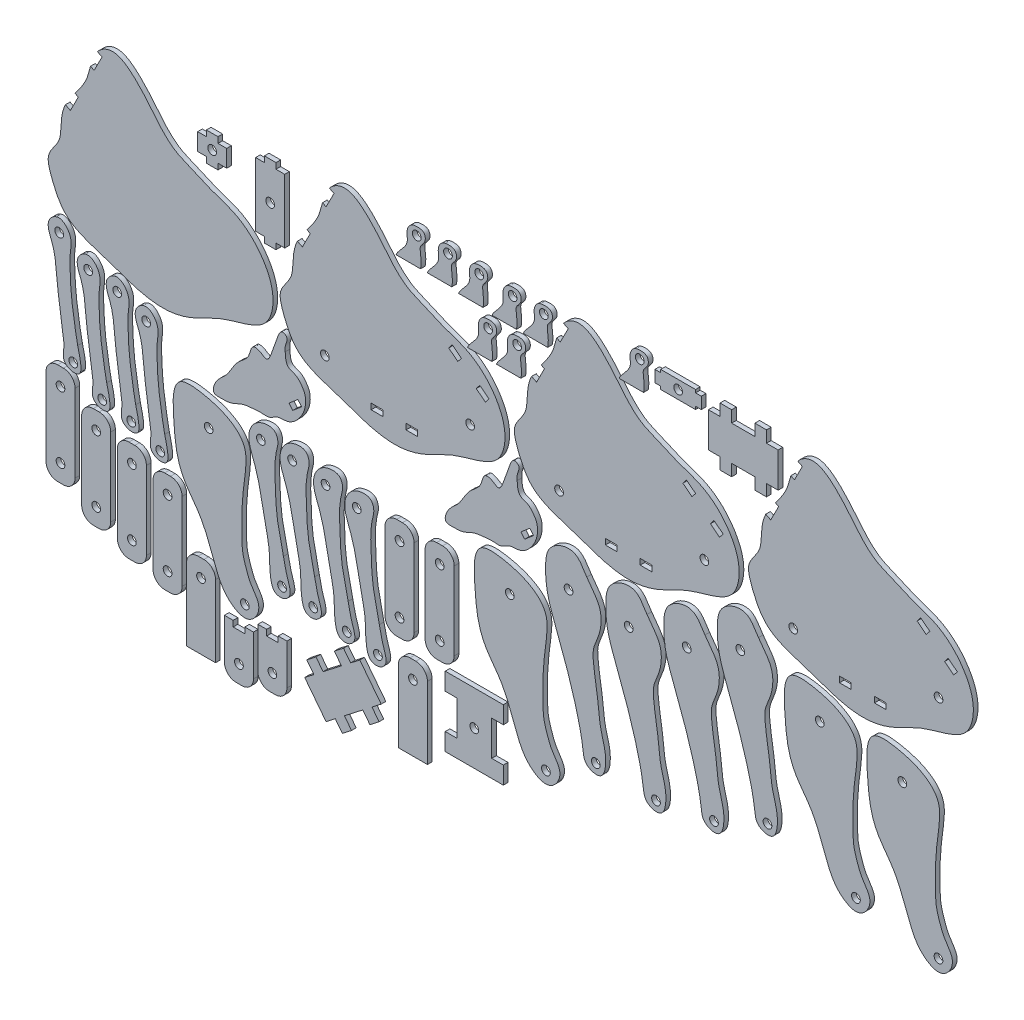
from build123d import *

# Parameters (mm, degrees)
MODEL_R                = 2.38125
BOSS_EXTRUDE1_DEPTH    = 2.54
BOSS_EXTRUDE1_2_DEPTH  = 2.54
MODEL_W                = 6.35
MODEL_H                = 3.175
BOSS_EXTRUDE1_3_DEPTH  = 2.54
BOSS_EXTRUDE1_4_DEPTH  = 2.54
BOSS_EXTRUDE1_5_DEPTH  = 2.54
BOSS_EXTRUDE1_6_DEPTH  = 2.54
BOSS_EXTRUDE1_7_DEPTH  = 2.54
BOSS_EXTRUDE1_8_DEPTH  = 2.54
BOSS_EXTRUDE1_9_DEPTH  = 2.54
BOSS_EXTRUDE1_10_DEPTH = 2.54
BOSS_EXTRUDE1_11_DEPTH = 2.54
BOSS_EXTRUDE1_12_DEPTH = 2.54
BOSS_EXTRUDE1_13_DEPTH = 2.54
BOSS_EXTRUDE1_14_DEPTH = 2.54
BOSS_EXTRUDE1_15_DEPTH = 2.54
BOSS_EXTRUDE1_16_DEPTH = 2.54
BOSS_EXTRUDE1_17_DEPTH = 2.54
BOSS_EXTRUDE1_18_DEPTH = 2.54
BOSS_EXTRUDE1_19_DEPTH = 2.54
BOSS_EXTRUDE1_20_DEPTH = 2.54
BOSS_EXTRUDE1_21_DEPTH = 2.54
BOSS_EXTRUDE1_22_DEPTH = 2.54
BOSS_EXTRUDE1_23_DEPTH = 2.54
BOSS_EXTRUDE1_24_DEPTH = 2.54
BOSS_EXTRUDE1_25_DEPTH = 2.54
BOSS_EXTRUDE1_26_DEPTH = 2.54
BOSS_EXTRUDE1_27_DEPTH = 2.54
BOSS_EXTRUDE1_28_DEPTH = 2.54
BOSS_EXTRUDE1_29_DEPTH = 2.54
BOSS_EXTRUDE1_30_DEPTH = 2.54
BOSS_EXTRUDE1_31_DEPTH = 2.54
BOSS_EXTRUDE1_32_DEPTH = 2.54
BOSS_EXTRUDE1_33_DEPTH = 2.54
BOSS_EXTRUDE1_34_DEPTH = 2.54
BOSS_EXTRUDE1_35_DEPTH = 2.54
BOSS_EXTRUDE1_36_DEPTH = 2.54
BOSS_EXTRUDE1_37_DEPTH = 2.54
BOSS_EXTRUDE1_38_DEPTH = 2.54
BOSS_EXTRUDE1_39_DEPTH = 2.54
BOSS_EXTRUDE1_40_DEPTH = 2.54
BOSS_EXTRUDE1_41_DEPTH = 2.54
BOSS_EXTRUDE1_42_DEPTH = 2.54
BOSS_EXTRUDE1_43_DEPTH = 2.54
BOSS_EXTRUDE1_44_DEPTH = 2.54
BOSS_EXTRUDE1_45_DEPTH = 2.54
BOSS_EXTRUDE1_46_DEPTH = 2.54


with BuildPart() as part:
    # Model → Boss-Extrude1 (new body)
    with BuildSketch(Plane.XY):
        Polygon((88.648005808, 248.103425007), (88.648005808, 257.501425007), (93.410505808, 257.501425007), (93.410505808, 260.676425007), (99.760505808, 260.676425007), (99.760505808, 257.501425007), (104.523005808, 257.501425007), (104.523005808, 248.103425007), (99.760505808, 248.103425007), (99.760505808, 244.928425007), (93.410505808, 244.928425007), (93.410505808, 248.103425007), align=None)
        with Locations((96.585505808, 252.802425007)):
            Circle(MODEL_R, mode=Mode.SUBTRACT)
    extrude(amount=BOSS_EXTRUDE1_DEPTH)


with BuildPart() as body_2:
    # Model → Boss-Extrude1 2 (new body)
    with BuildSketch(Plane.XY):
        Polygon((125.107490632, 261.093961602), (125.107490632, 264.268961602), (131.457490632, 264.268961602), (131.457490632, 261.093961602), (136.219990632, 261.093961602), (136.219990632, 226.168961602), (131.457490632, 226.168961602), (131.457490632, 222.993961602), (125.107490632, 222.993961602), (125.107490632, 226.168961602), (120.344990632, 226.168961602), (120.344990632, 261.093961602), align=None)
        with Locations((128.282490632, 243.631461602)):
            Circle(MODEL_R, mode=Mode.SUBTRACT)
    extrude(amount=BOSS_EXTRUDE1_2_DEPTH)


with BuildPart() as body_3:
    # Model → Boss-Extrude1 3 (new body)
    with BuildSketch(Plane.XY):
        with BuildLine():
            Line((145.880502868, 231.529608205), (143.166311499, 232.911205122))
            add(Edge.make_bspline(
                [(143.166311499, 232.911205122), (142.716383117, 231.989297683), (141.096791933, 228.063260503), (140.718036248, 221.741241161), (140.194792919, 212.443120236), (132.038202817, 205.734199668), (136.064707933, 192.599362016), (143.347472986, 176.876955583), (164.454316, 171.974233921), (182.194817562, 164.664395794), (198.568210286, 162.273634725), (214.172001811, 166.597778017), (227.830577654, 175.002712785), (241.973743075, 177.878513308), (254.085508749, 183.706957315), (258.494178761, 198.45442841), (251.844134376, 215.331757009), (237.952449535, 228.07367733), (223.155735014, 231.855560997), (212.996563339, 236.958591736), (200.492071838, 241.319738223), (191.303233754, 252.976535574), (181.510065648, 264.712681311), (170.384391065, 273.283752098), (163.181849451, 269.34900819), (161.542176613, 267.74024814), (161.223881959, 267.427954303), (160.928484227, 267.101300839), (160.653383952, 266.761824378)],
                knots=[0.111717033, 0.111717033, 0.111717033, 0.111717033, 0.120673769, 0.148903991, 0.164165853, 0.198706746, 0.223618805, 0.271958724, 0.340540865, 0.391818428, 0.438500031, 0.477150294, 0.527177937, 0.572977177, 0.600307039, 0.636040267, 0.690679969, 0.746912916, 0.789386341, 0.818681817, 0.843719063, 0.900659232, 0.937482649, 0.980493711, 1, 1, 1, 1.003786577, 1.003786577, 1.003786577, 1.003786577], degree=3))
            Line((160.653383952, 266.761824378), (163.164105613, 265.483799055))
            Line((163.164105613, 265.483799055), (158.843204926, 256.99525134))
            Line((158.843204926, 256.99525134), (156.892309132, 257.988310139))
            add(Edge.make_bspline(
                [(156.892309132, 257.988310139), (156.285114723, 255.691702896), (154.742688223, 249.307227776), (150.844009203, 244.152191963), (148.423358763, 240.923228872)],
                knots=[0.031107105, 0.031107105, 0.031107105, 0.031107105, 0.050670343, 0.084416466, 0.084416466, 0.084416466, 0.084416466], degree=3))
            Line((148.423358763, 240.923228872), (150.201403556, 240.018155917))
            Line((150.201403556, 240.018155917), (145.880502868, 231.529608205))
        make_face()
        with Locations((237.603757181, 193.287801903)):
            Circle(MODEL_R, mode=Mode.SUBTRACT)
        with Locations((158.182191028, 186.334551948)):
            Circle(MODEL_R, mode=Mode.SUBTRACT)
        with Locations((205.70992201, 174.833471323)):
            Rectangle(MODEL_W, MODEL_H, mode=Mode.SUBTRACT)
        with Locations((186.65992201, 174.833471323)):
            Rectangle(MODEL_W, MODEL_H, mode=Mode.SUBTRACT)
        Polygon((245.935614152, 208.131362924), (240.91683806, 212.021656815), (242.861985008, 214.531044859), (247.880761097, 210.640750968), align=None, mode=Mode.SUBTRACT)
        Polygon((227.805656739, 226.201926536), (232.824432828, 222.311632643), (230.879285883, 219.802244599), (225.860509794, 223.692538489), align=None, mode=Mode.SUBTRACT)
    extrude(amount=BOSS_EXTRUDE1_3_DEPTH)


with BuildPart() as body_4:
    # Model → Boss-Extrude1 4 (new body)
    with BuildSketch(Plane.XY):
        with BuildLine():
            add(Edge.make_bspline(
                [(197.14921886, 253.458493188), (198.221138496, 256.565680307), (204.744294263, 260.567384427), (202.375955295, 267.725571358), (204.800633298, 271.953761777), (208.582379665, 272.66991652), (213.002076358, 272.210843625), (213.469583738, 266.951735902), (209.89876913, 264.616110925), (210.744538477, 259.332298088), (211.014716514, 255.988816761), (210.459697284, 253.458493188)],
                knots=[0, 0, 0, 0, 0.237102494, 0.355084778, 0.441469893, 0.511003909, 0.597826044, 0.684225284, 0.771372373, 0.837925106, 1, 1, 1, 1], degree=3))
            Line((210.459697284, 253.458493188), (197.14921886, 253.458493188))
        make_face()
        with Locations((208.394278219, 268.184942589)):
            Circle(MODEL_R, mode=Mode.SUBTRACT)
    extrude(amount=BOSS_EXTRUDE1_4_DEPTH)


with BuildPart() as body_5:
    # Model → Boss-Extrude1 5 (new body)
    with BuildSketch(Plane.XY):
        with BuildLine():
            add(Edge.make_bspline(
                [(214.216823841, 253.458493188), (215.288743477, 256.565680307), (221.811899244, 260.567384427), (219.443560276, 267.725571358), (221.868238279, 271.953761777), (225.649984646, 272.66991652), (230.069681339, 272.210843625), (230.537188719, 266.951735902), (226.966374111, 264.616110925), (227.812143459, 259.332298088), (228.082321495, 255.988816761), (227.527302265, 253.458493188)],
                knots=[0, 0, 0, 0, 0.237102494, 0.355084778, 0.441469893, 0.511003909, 0.597826044, 0.684225284, 0.771372373, 0.837925106, 1, 1, 1, 1], degree=3))
            Line((227.527302265, 253.458493188), (214.216823841, 253.458493188))
        make_face()
        with Locations((225.4618832, 268.184942589)):
            Circle(MODEL_R, mode=Mode.SUBTRACT)
    extrude(amount=BOSS_EXTRUDE1_5_DEPTH)


with BuildPart() as body_6:
    # Model → Boss-Extrude1 6 (new body)
    with BuildSketch(Plane.XY):
        with BuildLine():
            add(Edge.make_bspline(
                [(231.284434599, 252.239912814), (232.356354235, 255.347099933), (238.879510002, 259.348804053), (236.511171034, 266.506990984), (238.935849037, 270.735181403), (242.717595404, 271.451336146), (247.137292097, 270.992263251), (247.604799477, 265.733155528), (244.033984869, 263.397530551), (244.879754217, 258.113717714), (245.149932253, 254.770236387), (244.594913023, 252.239912814)],
                knots=[0, 0, 0, 0, 0.237102494, 0.355084778, 0.441469893, 0.511003909, 0.597826044, 0.684225284, 0.771372373, 0.837925106, 1, 1, 1, 1], degree=3))
            Line((244.594913023, 252.239912814), (231.284434599, 252.239912814))
        make_face()
        with Locations((242.529493958, 266.966362215)):
            Circle(MODEL_R, mode=Mode.SUBTRACT)
    extrude(amount=BOSS_EXTRUDE1_6_DEPTH)


with BuildPart() as body_7:
    # Model → Boss-Extrude1 7 (new body)
    with BuildSketch(Plane.XY):
        with BuildLine():
            add(Edge.make_bspline(
                [(249.571155047, 251.02132966), (250.643074683, 254.128516779), (257.16623045, 258.130220898), (254.797891482, 265.288407829), (257.222569485, 269.516598248), (261.004315852, 270.232752992), (265.424012545, 269.773680097), (265.891519925, 264.514572373), (262.320705317, 262.178947397), (263.166474665, 256.89513456), (263.436652701, 253.551653233), (262.881633471, 251.02132966)],
                knots=[0, 0, 0, 0, 0.237102494, 0.355084778, 0.441469893, 0.511003909, 0.597826044, 0.684225284, 0.771372373, 0.837925106, 1, 1, 1, 1], degree=3))
            Line((262.881633471, 251.02132966), (249.571155047, 251.02132966))
        make_face()
        with Locations((260.816214406, 265.747779061)):
            Circle(MODEL_R, mode=Mode.SUBTRACT)
    extrude(amount=BOSS_EXTRUDE1_7_DEPTH)


with BuildPart() as body_8:
    # Model → Boss-Extrude1 8 (new body)
    with BuildSketch(Plane.XY):
        with BuildLine():
            add(Edge.make_bspline(
                [(266.638760029, 251.02132966), (267.710679664, 254.128516779), (274.233835431, 258.130220898), (271.865496463, 265.288407829), (274.290174466, 269.516598248), (278.071920834, 270.232752992), (282.491617526, 269.773680097), (282.959124906, 264.514572373), (279.388310298, 262.178947397), (280.234079646, 256.89513456), (280.504257683, 253.551653233), (279.949238452, 251.02132966)],
                knots=[0, 0, 0, 0, 0.237102494, 0.355084778, 0.441469893, 0.511003909, 0.597826044, 0.684225284, 0.771372373, 0.837925106, 1, 1, 1, 1], degree=3))
            Line((279.949238452, 251.02132966), (266.638760029, 251.02132966))
        make_face()
        with Locations((277.883819388, 265.747779061)):
            Circle(MODEL_R, mode=Mode.SUBTRACT)
    extrude(amount=BOSS_EXTRUDE1_8_DEPTH)


with BuildPart() as body_9:
    # Model → Boss-Extrude1 9 (new body)
    with BuildSketch(Plane.XY):
        with BuildLine():
            add(Edge.make_bspline(
                [(252.009385981, 229.086866246), (253.081305617, 232.194053365), (259.604461384, 236.195757484), (257.236122416, 243.353944416), (259.660800418, 247.582134835), (263.442546786, 248.298289578), (267.862243479, 247.839216683), (268.329750859, 242.58010896), (264.758936251, 240.244483983), (265.604705598, 234.960671146), (265.874883635, 231.617189819), (265.319864404, 229.086866246)],
                knots=[0, 0, 0, 0, 0.237102494, 0.355084778, 0.441469893, 0.511003909, 0.597826044, 0.684225284, 0.771372373, 0.837925106, 1, 1, 1, 1], degree=3))
            Line((265.319864404, 229.086866246), (252.009385981, 229.086866246))
        make_face()
        with Locations((263.25444534, 243.813315647)):
            Circle(MODEL_R, mode=Mode.SUBTRACT)
    extrude(amount=BOSS_EXTRUDE1_9_DEPTH)


with BuildPart() as body_10:
    # Model → Boss-Extrude1 10 (new body)
    with BuildSketch(Plane.XY):
        with BuildLine():
            add(Edge.make_bspline(
                [(236.16089069, 229.086866246), (237.232810325, 232.194053365), (243.755966092, 236.195757484), (241.387627124, 243.353944416), (243.812305127, 247.582134835), (247.594051495, 248.298289578), (252.013748187, 247.839216683), (252.481255567, 242.58010896), (248.910440959, 240.244483983), (249.756210307, 234.960671146), (250.026388344, 231.617189819), (249.471369113, 229.086866246)],
                knots=[0, 0, 0, 0, 0.237102494, 0.355084778, 0.441469893, 0.511003909, 0.597826044, 0.684225284, 0.771372373, 0.837925106, 1, 1, 1, 1], degree=3))
            Line((249.471369113, 229.086866246), (236.16089069, 229.086866246))
        make_face()
        with Locations((247.405950049, 243.813315647)):
            Circle(MODEL_R, mode=Mode.SUBTRACT)
    extrude(amount=BOSS_EXTRUDE1_10_DEPTH)


with BuildPart() as body_11:
    # Model → Boss-Extrude1 11 (new body)
    with BuildSketch(Plane.XY):
        with BuildLine():
            Line((273.887551781, 231.529608205), (271.173360412, 232.911205122))
            add(Edge.make_bspline(
                [(271.173360412, 232.911205122), (270.72343203, 231.989297683), (269.103840846, 228.063260503), (268.725085161, 221.741241161), (268.201841832, 212.443120236), (260.045251729, 205.734199668), (264.071756846, 192.599362016), (271.354521899, 176.876955583), (292.461364913, 171.974233921), (310.201866474, 164.664395794), (326.575259199, 162.273634725), (342.179050723, 166.597778017), (355.837626567, 175.002712785), (369.980791987, 177.878513308), (382.092557662, 183.706957315), (386.501227674, 198.45442841), (379.851183289, 215.331757009), (365.959498448, 228.07367733), (351.162783927, 231.855560997), (341.003612252, 236.958591736), (328.499120751, 241.319738223), (319.310282667, 252.976535574), (309.517114561, 264.712681311), (298.391439978, 273.283752098), (291.188898364, 269.34900819), (289.549225526, 267.74024814), (289.230930872, 267.427954303), (288.93553314, 267.101300839), (288.660432865, 266.761824378)],
                knots=[0.111717033, 0.111717033, 0.111717033, 0.111717033, 0.120673769, 0.148903991, 0.164165853, 0.198706746, 0.223618805, 0.271958724, 0.340540865, 0.391818428, 0.438500031, 0.477150294, 0.527177937, 0.572977177, 0.600307039, 0.636040267, 0.690679969, 0.746912916, 0.789386341, 0.818681817, 0.843719063, 0.900659232, 0.937482649, 0.980493711, 1, 1, 1, 1.003786577, 1.003786577, 1.003786577, 1.003786577], degree=3))
            Line((288.660432865, 266.761824378), (291.171154526, 265.483799055))
            Line((291.171154526, 265.483799055), (286.850253839, 256.99525134))
            Line((286.850253839, 256.99525134), (284.899358045, 257.988310139))
            add(Edge.make_bspline(
                [(284.899358045, 257.988310139), (284.292163636, 255.691702896), (282.749737136, 249.307227776), (278.851058116, 244.152191963), (276.430407676, 240.923228872)],
                knots=[0.031107105, 0.031107105, 0.031107105, 0.031107105, 0.050670343, 0.084416466, 0.084416466, 0.084416466, 0.084416466], degree=3))
            Line((276.430407676, 240.923228872), (278.208452468, 240.018155917))
            Line((278.208452468, 240.018155917), (273.887551781, 231.529608205))
        make_face()
        with Locations((365.610806094, 193.287801903)):
            Circle(MODEL_R, mode=Mode.SUBTRACT)
        with Locations((286.189239941, 186.334551948)):
            Circle(MODEL_R, mode=Mode.SUBTRACT)
        with Locations((333.716970923, 174.833471323)):
            Rectangle(MODEL_W, MODEL_H, mode=Mode.SUBTRACT)
        with Locations((314.666970923, 174.833471323)):
            Rectangle(MODEL_W, MODEL_H, mode=Mode.SUBTRACT)
        Polygon((373.942663065, 208.131362924), (368.923886973, 212.021656815), (370.869033921, 214.531044859), (375.88781001, 210.640750968), align=None, mode=Mode.SUBTRACT)
        Polygon((355.812705652, 226.201926536), (360.831481741, 222.311632643), (358.886334795, 219.802244599), (353.867558706, 223.692538489), align=None, mode=Mode.SUBTRACT)
    extrude(amount=BOSS_EXTRUDE1_11_DEPTH)


with BuildPart() as body_12:
    # Model → Boss-Extrude1 12 (new body)
    with BuildSketch(Plane.XY):
        with BuildLine():
            add(Edge.make_bspline(
                [(263.299624276, 179.652063381), (263.241981149, 180.859426047), (263.12906818, 183.150915031), (265.225764634, 186.625350208), (260.678120712, 189.738589425), (258.837334009, 183.271405269), (256.950884143, 179.075576595), (255.849672524, 175.068902114), (253.609625622, 169.783248822), (249.821036331, 173.033387233), (245.860062411, 174.163908015), (244.071712828, 170.617005334), (243.240982011, 165.986291116), (235.860455394, 161.774406799), (232.414088718, 152.38598108), (225.398530726, 148.286895828), (223.450545935, 141.784178074), (224.43328026, 140.785719364)],
                knots=[0.516873244, 0.516873244, 0.516873244, 0.516873244, 0.538667761, 0.562806149, 0.5778991, 0.616936064, 0.645339628, 0.673283981, 0.701186966, 0.724121111, 0.750378426, 0.764142362, 0.791670233, 0.838296487, 0.910523172, 0.966353976, 1, 1, 1, 1], degree=3))
            add(Edge.make_bspline(
                [(224.43328026, 140.785719364), (225.177482966, 140.029608932), (229.079673387, 140.195746086), (234.039222499, 140.14067572), (239.191465944, 143.380432086), (244.845324945, 143.867293863), (249.623813898, 144.496380293), (253.964397791, 143.691265353), (256.837200083, 145.477270748), (259.937286688, 147.266690273), (265.387732358, 146.542827606), (271.166749485, 151.48129139), (274.64471859, 158.246434834), (274.612580923, 164.630286604), (271.958481614, 168.761760035), (269.394206183, 171.811078936), (263.617928641, 172.771599367), (263.411740885, 177.303727807), (263.299624276, 179.652063381)],
                knots=[0, 0, 0, 0, 0.025479381, 0.057543235, 0.099955641, 0.133033817, 0.163895948, 0.191559966, 0.211929865, 0.225609617, 0.258491648, 0.308276257, 0.356004359, 0.401628858, 0.418999158, 0.448323204, 0.474482632, 0.516873244, 0.516873244, 0.516873244, 0.516873244], degree=3))
        make_face()
        Polygon((272.250986165, 158.097804863), (270.188988613, 160.512093804), (265.360410731, 156.388098696), (267.422408284, 153.973809756), align=None, mode=Mode.SUBTRACT)
    extrude(amount=BOSS_EXTRUDE1_12_DEPTH)


with BuildPart() as body_13:
    # Model → Boss-Extrude1 13 (new body)
    with BuildSketch(Plane.XY):
        with BuildLine():
            add(Edge.make_bspline(
                [(136.51169083, 177.214902633), (136.454047703, 178.422265299), (136.341134734, 180.713754283), (138.437831188, 184.18818946), (133.890187266, 187.301428677), (132.049400563, 180.834244521), (130.162950697, 176.638415847), (129.061739078, 172.631741366), (126.821692176, 167.346088074), (123.033102885, 170.596226486), (119.072128965, 171.726747267), (117.283779382, 168.179844586), (116.453048565, 163.549130368), (109.072521948, 159.337246051), (105.626155272, 149.948820332), (98.61059728, 145.84973508), (96.662612489, 139.347017326), (97.645346813, 138.348558616)],
                knots=[0.516873244, 0.516873244, 0.516873244, 0.516873244, 0.538667761, 0.562806149, 0.5778991, 0.616936064, 0.645339628, 0.673283981, 0.701186966, 0.724121111, 0.750378426, 0.764142362, 0.791670233, 0.838296487, 0.910523172, 0.966353976, 1, 1, 1, 1], degree=3))
            add(Edge.make_bspline(
                [(97.645346813, 138.348558616), (98.38954952, 137.592448184), (102.291739941, 137.758585338), (107.251289053, 137.703514972), (112.403532498, 140.943271338), (118.057391499, 141.430133115), (122.835880452, 142.059219545), (127.176464345, 141.254104605), (130.049266637, 143.04011), (133.149353242, 144.829529526), (138.599798912, 144.105666858), (144.378816039, 149.044130642), (147.856785144, 155.809274086), (147.824647477, 162.193125857), (145.170548168, 166.324599287), (142.606272737, 169.373918188), (136.829995195, 170.334438619), (136.623807439, 174.866567059), (136.51169083, 177.214902633)],
                knots=[0, 0, 0, 0, 0.025479381, 0.057543235, 0.099955641, 0.133033817, 0.163895948, 0.191559966, 0.211929865, 0.225609617, 0.258491648, 0.308276257, 0.356004359, 0.401628858, 0.418999158, 0.448323204, 0.474482632, 0.516873244, 0.516873244, 0.516873244, 0.516873244], degree=3))
        make_face()
        Polygon((145.463052719, 155.660644115), (143.401055167, 158.074933056), (138.572477285, 153.950937949), (140.634474838, 151.536649008), align=None, mode=Mode.SUBTRACT)
    extrude(amount=BOSS_EXTRUDE1_13_DEPTH)


with BuildPart() as body_14:
    # Model → Boss-Extrude1 14 (new body)
    with BuildSketch(Plane.XY):
        with BuildLine():
            add(Edge.make_bspline(
                [(319.060696216, 255.895653936), (320.132615852, 259.002841055), (326.655771619, 263.004545174), (324.287432651, 270.162732106), (326.712110653, 274.390922525), (330.493857021, 275.107077268), (334.913553714, 274.648004373), (335.381061094, 269.38889665), (331.810246485, 267.053271673), (332.656015833, 261.769458836), (332.92619387, 258.425977509), (332.371174639, 255.895653936)],
                knots=[0, 0, 0, 0, 0.237102494, 0.355084778, 0.441469893, 0.511003909, 0.597826044, 0.684225284, 0.771372373, 0.837925106, 1, 1, 1, 1], degree=3))
            Line((332.371174639, 255.895653936), (319.060696216, 255.895653936))
        make_face()
        with Locations((330.305755575, 270.622103337)):
            Circle(MODEL_R, mode=Mode.SUBTRACT)
    extrude(amount=BOSS_EXTRUDE1_14_DEPTH)


with BuildPart() as body_15:
    # Model → Boss-Extrude1 15 (new body)
    with BuildSketch(Plane.XY):
        Polygon((341.741532095, 269.926061371), (341.741532095, 271.513561371), (360.791532095, 271.513561371), (360.791532095, 269.926061371), (363.966532095, 269.926061371), (363.966532095, 263.576061371), (360.791532095, 263.576061371), (360.791532095, 261.988561371), (341.741532095, 261.988561371), (341.741532095, 263.576061371), (338.566532095, 263.576061371), (338.566532095, 269.926061371), align=None)
        with Locations((351.266532095, 266.751061371)):
            Circle(MODEL_R, mode=Mode.SUBTRACT)
    extrude(amount=BOSS_EXTRUDE1_15_DEPTH)


with BuildPart() as body_16:
    # Model → Boss-Extrude1 16 (new body)
    with BuildSketch(Plane.XY):
        Polygon((393.22528591, 240.054097955), (393.22528591, 246.404097955), (380.52528591, 246.404097955), (380.52528591, 240.054097955), (374.17528591, 240.054097955), (374.17528591, 246.404097955), (367.82528591, 246.404097955), (367.82528591, 265.454097955), (374.17528591, 265.454097955), (374.17528591, 271.804097955), (380.52528591, 271.804097955), (380.52528591, 265.454097955), (393.22528591, 265.454097955), (393.22528591, 271.804097955), (399.57528591, 271.804097955), (399.57528591, 265.454097955), (405.92528591, 265.454097955), (405.92528591, 246.404097955), (399.57528591, 246.404097955), (399.57528591, 240.054097955), align=None)
    extrude(amount=BOSS_EXTRUDE1_16_DEPTH)


with BuildPart() as body_17:
    # Model → Boss-Extrude1 17 (new body)
    with BuildSketch(Plane.XY):
        with BuildLine():
            Line((401.894600694, 230.311027831), (399.180409325, 231.692624748))
            add(Edge.make_bspline(
                [(399.180409325, 231.692624748), (398.730480943, 230.770717309), (397.110889759, 226.844680129), (396.732134074, 220.522660787), (396.208890744, 211.224539862), (388.052300642, 204.515619294), (392.078805759, 191.380781642), (399.361570811, 175.658375209), (420.468413825, 170.755653547), (438.208915387, 163.44581542), (454.582308112, 161.055054351), (470.186099636, 165.379197644), (483.84467548, 173.784132411), (497.9878409, 176.659932934), (510.099606575, 182.488376941), (514.508276587, 197.235848036), (507.858232202, 214.113176636), (493.966547361, 226.855096956), (479.16983284, 230.636980623), (469.010661165, 235.740011362), (456.506169664, 240.101157849), (447.317331579, 251.7579552), (437.524163474, 263.494100937), (426.398488891, 272.065171724), (419.195947277, 268.130427816), (417.556274439, 266.521667766), (417.237979785, 266.209373929), (416.942582053, 265.882720465), (416.667481778, 265.543244004)],
                knots=[0.111717033, 0.111717033, 0.111717033, 0.111717033, 0.120673769, 0.148903991, 0.164165853, 0.198706746, 0.223618805, 0.271958724, 0.340540865, 0.391818428, 0.438500031, 0.477150294, 0.527177937, 0.572977177, 0.600307039, 0.636040267, 0.690679969, 0.746912916, 0.789386341, 0.818681817, 0.843719063, 0.900659232, 0.937482649, 0.980493711, 1, 1, 1, 1.003786577, 1.003786577, 1.003786577, 1.003786577], degree=3))
            Line((416.667481778, 265.543244004), (419.178203439, 264.265218681))
            Line((419.178203439, 264.265218681), (414.857302751, 255.776670966))
            Line((414.857302751, 255.776670966), (412.906406958, 256.769729765))
            add(Edge.make_bspline(
                [(412.906406958, 256.769729765), (412.299212549, 254.473122522), (410.756786049, 248.088647402), (406.858107029, 242.933611589), (404.437456588, 239.704648498)],
                knots=[0.031107105, 0.031107105, 0.031107105, 0.031107105, 0.050670343, 0.084416466, 0.084416466, 0.084416466, 0.084416466], degree=3))
            Line((404.437456588, 239.704648498), (406.215501381, 238.799575543))
            Line((406.215501381, 238.799575543), (401.894600694, 230.311027831))
        make_face()
        with Locations((493.617855007, 192.069221529)):
            Circle(MODEL_R, mode=Mode.SUBTRACT)
        with Locations((414.196288854, 185.115971574)):
            Circle(MODEL_R, mode=Mode.SUBTRACT)
        with Locations((461.724019836, 173.614890949)):
            Rectangle(MODEL_W, MODEL_H, mode=Mode.SUBTRACT)
        with Locations((442.674019836, 173.614890949)):
            Rectangle(MODEL_W, MODEL_H, mode=Mode.SUBTRACT)
        Polygon((501.949711978, 206.91278255), (496.930935886, 210.803076441), (498.876082834, 213.312464485), (503.894858923, 209.422170595), align=None, mode=Mode.SUBTRACT)
        Polygon((483.819754565, 224.983346162), (488.838530654, 221.093052269), (486.893383708, 218.583664225), (481.874607619, 222.473958115), align=None, mode=Mode.SUBTRACT)
    extrude(amount=BOSS_EXTRUDE1_17_DEPTH)


with BuildPart() as body_18:
    # Model → Boss-Extrude1 18 (new body)
    with BuildSketch(Plane.XY):
        with BuildLine():
            add(Edge.make_bspline(
                [(500.106266209, 66.636149591), (500.992694915, 68.287724645), (502.035740007, 73.227919443), (496.953466476, 78.675739778), (494.269200758, 85.829892452), (491.816661547, 93.330524017), (492.020407497, 102.432484095), (491.684815872, 114.43405555), (493.391325284, 127.357085859), (496.078711515, 148.410499085), (476.054264234, 156.87350319), (461.109981827, 158.003275783), (458.491633784, 156.448044677)],
                knots=[0.496264859, 0.496264859, 0.496264859, 0.496264859, 0.519240724, 0.556864446, 0.58362393, 0.618875008, 0.657601159, 0.700502293, 0.77344688, 0.830648391, 0.952543987, 1, 1, 1, 1], degree=3))
            add(Edge.make_bspline(
                [(458.491633784, 156.448044677), (453.720550929, 153.614144699), (454.743748495, 132.557176384), (456.78383643, 113.721855283), (471.095995661, 97.234022757), (476.345836767, 80.623827147), (482.812833179, 66.128281152), (494.40009239, 60.340073635), (499.011017191, 64.595504986), (500.106266209, 66.636149591)],
                knots=[0, 0, 0, 0, 0.086473061, 0.201223986, 0.263840681, 0.357440163, 0.42530964, 0.467876457, 0.496264859, 0.496264859, 0.496264859, 0.496264859], degree=3))
        make_face()
        with Locations((493.579321876, 68.568012903)):
            Circle(MODEL_R, mode=Mode.SUBTRACT)
        with Locations((473.824999856, 142.162895617)):
            Circle(MODEL_R, mode=Mode.SUBTRACT)
    extrude(amount=BOSS_EXTRUDE1_18_DEPTH)


with BuildPart() as body_19:
    # Model → Boss-Extrude1 19 (new body)
    with BuildSketch(Plane.XY):
        with BuildLine():
            add(Edge.make_bspline(
                [(454.999022823, 72.729054241), (455.885451528, 74.380629295), (456.928496621, 79.320824094), (451.846223089, 84.768644428), (449.161957371, 91.922797103), (446.709418161, 99.423428667), (446.913164111, 108.525388746), (446.577572486, 120.526960201), (448.284081897, 133.449990509), (450.971468129, 154.503403735), (430.947020847, 162.96640784), (416.00273844, 164.096180433), (413.384390397, 162.540949328)],
                knots=[0.496264859, 0.496264859, 0.496264859, 0.496264859, 0.519240724, 0.556864446, 0.58362393, 0.618875008, 0.657601159, 0.700502293, 0.77344688, 0.830648391, 0.952543987, 1, 1, 1, 1], degree=3))
            add(Edge.make_bspline(
                [(413.384390397, 162.540949328), (408.613307542, 159.707049349), (409.636505109, 138.650081034), (411.676593043, 119.814759933), (425.988752275, 103.326927407), (431.23859338, 86.716731797), (437.705589793, 72.221185802), (449.292849003, 66.432978285), (453.903773805, 70.688409636), (454.999022823, 72.729054241)],
                knots=[0, 0, 0, 0, 0.086473061, 0.201223986, 0.263840681, 0.357440163, 0.42530964, 0.467876457, 0.496264859, 0.496264859, 0.496264859, 0.496264859], degree=3))
        make_face()
        with Locations((448.472078489, 74.660917553)):
            Circle(MODEL_R, mode=Mode.SUBTRACT)
        with Locations((428.717756469, 148.255800267)):
            Circle(MODEL_R, mode=Mode.SUBTRACT)
    extrude(amount=BOSS_EXTRUDE1_19_DEPTH)


with BuildPart() as body_20:
    # Model → Boss-Extrude1 20 (new body)
    with BuildSketch(Plane.XY):
        with BuildLine():
            add(Edge.make_bspline(
                [(395.200113675, 171.285267524), (393.116414129, 174.402368023), (388.993586041, 182.725696545), (373.550793521, 177.044195916), (372.401629759, 164.49853627), (373.118075148, 153.029869863), (378.655876197, 137.965015414), (385.143611599, 121.206584402), (390.343034919, 103.510207245), (392.57438803, 93.13976791), (393.135311146, 88.505457048)],
                knots=[0.485935555, 0.485935555, 0.485935555, 0.485935555, 0.533485289, 0.596799765, 0.638978483, 0.694684703, 0.752921318, 0.85362628, 0.938944148, 1, 1, 1, 1], degree=3))
            add(Edge.make_bspline(
                [(393.135311146, 88.505457048), (393.373323309, 86.539015803), (393.78320615, 81.704360575), (404.145487903, 78.533410455), (405.985579041, 88.621233115), (404.928515341, 96.142457036), (402.173665304, 104.722776909), (401.439933388, 116.865415805), (399.136494401, 128.348337095), (398.219801099, 139.525435682), (402.956902837, 148.169792248), (404.024830809, 160.958693349), (397.749774382, 167.471114627), (395.200113675, 171.285267524)],
                knots=[0, 0, 0, 0, 0.025907357, 0.061945247, 0.099210204, 0.132366352, 0.170723321, 0.218452269, 0.29619423, 0.330868793, 0.365117885, 0.427752651, 0.485935555, 0.485935555, 0.485935555, 0.485935555], degree=3))
        make_face()
        with Locations((400.123158849, 85.663433847)):
            Circle(MODEL_R, mode=Mode.SUBTRACT)
        with Locations((385.251519671, 160.398126917)):
            Circle(MODEL_R, mode=Mode.SUBTRACT)
    extrude(amount=BOSS_EXTRUDE1_20_DEPTH)


with BuildPart() as body_21:
    # Model → Boss-Extrude1 21 (new body)
    with BuildSketch(Plane.XY):
        with BuildLine():
            add(Edge.make_bspline(
                [(365.941359803, 157.880872289), (363.857660257, 160.997972787), (359.734832169, 169.32130131), (344.292039649, 163.639800681), (343.142875887, 151.094141034), (343.859321276, 139.625474627), (349.397122325, 124.560620178), (355.884857727, 107.802189167), (361.084281046, 90.10581201), (363.315634158, 79.735372675), (363.876557274, 75.101061813)],
                knots=[0.485935555, 0.485935555, 0.485935555, 0.485935555, 0.533485289, 0.596799765, 0.638978483, 0.694684703, 0.752921318, 0.85362628, 0.938944148, 1, 1, 1, 1], degree=3))
            add(Edge.make_bspline(
                [(363.876557274, 75.101061813), (364.114569437, 73.134620568), (364.524452278, 68.29996534), (374.886734031, 65.12901522), (376.726825169, 75.21683788), (375.669761469, 82.738061801), (372.914911431, 91.318381674), (372.181179515, 103.46102057), (369.877740529, 114.94394186), (368.961047227, 126.121040446), (373.698148965, 134.765397013), (374.766076937, 147.554298114), (368.49102051, 154.066719392), (365.941359803, 157.880872289)],
                knots=[0, 0, 0, 0, 0.025907357, 0.061945247, 0.099210204, 0.132366352, 0.170723321, 0.218452269, 0.29619423, 0.330868793, 0.365117885, 0.427752651, 0.485935555, 0.485935555, 0.485935555, 0.485935555], degree=3))
        make_face()
        with Locations((370.864404976, 72.259038612)):
            Circle(MODEL_R, mode=Mode.SUBTRACT)
        with Locations((355.992765799, 146.993731682)):
            Circle(MODEL_R, mode=Mode.SUBTRACT)
    extrude(amount=BOSS_EXTRUDE1_21_DEPTH)


with BuildPart() as body_22:
    # Model → Boss-Extrude1 22 (new body)
    with BuildSketch(Plane.XY):
        with BuildLine():
            add(Edge.make_bspline(
                [(334.244380774, 151.787967639), (332.160681228, 154.905068137), (328.03785314, 163.228396659), (312.59506062, 157.546896031), (311.445896858, 145.001236384), (312.162342247, 133.532569977), (317.700143296, 118.467715528), (324.187878698, 101.709284517), (329.387302018, 84.012907359), (331.618655129, 73.642468024), (332.179578245, 69.008157163)],
                knots=[0.485935555, 0.485935555, 0.485935555, 0.485935555, 0.533485289, 0.596799765, 0.638978483, 0.694684703, 0.752921318, 0.85362628, 0.938944148, 1, 1, 1, 1], degree=3))
            add(Edge.make_bspline(
                [(332.179578245, 69.008157163), (332.417590408, 67.041715918), (332.827473249, 62.20706069), (343.189755002, 59.03611057), (345.02984614, 69.123933229), (343.97278244, 76.645157151), (341.217932403, 85.225477024), (340.484200487, 97.36811592), (338.1807615, 108.85103721), (337.264068198, 120.028135796), (342.001169937, 128.672492362), (343.069097908, 141.461393464), (336.794041481, 147.973814742), (334.244380774, 151.787967639)],
                knots=[0, 0, 0, 0, 0.025907357, 0.061945247, 0.099210204, 0.132366352, 0.170723321, 0.218452269, 0.29619423, 0.330868793, 0.365117885, 0.427752651, 0.485935555, 0.485935555, 0.485935555, 0.485935555], degree=3))
        make_face()
        with Locations((339.167425948, 66.166133962)):
            Circle(MODEL_R, mode=Mode.SUBTRACT)
        with Locations((324.29578677, 140.900827032)):
            Circle(MODEL_R, mode=Mode.SUBTRACT)
    extrude(amount=BOSS_EXTRUDE1_22_DEPTH)


with BuildPart() as body_23:
    # Model → Boss-Extrude1 23 (new body)
    with BuildSketch(Plane.XY):
        with BuildLine():
            add(Edge.make_bspline(
                [(301.328280502, 153.006548013), (299.244580955, 156.123648511), (295.121752868, 164.446977033), (279.678960348, 158.765476405), (278.529796585, 146.219816758), (279.246241975, 134.751150351), (284.784043023, 119.686295902), (291.271778426, 102.927864891), (296.471201745, 85.231487733), (298.702554857, 74.861048398), (299.263477973, 70.226737536)],
                knots=[0.485935555, 0.485935555, 0.485935555, 0.485935555, 0.533485289, 0.596799765, 0.638978483, 0.694684703, 0.752921318, 0.85362628, 0.938944148, 1, 1, 1, 1], degree=3))
            add(Edge.make_bspline(
                [(299.263477973, 70.226737536), (299.501490136, 68.260296292), (299.911372977, 63.425641064), (310.273654729, 60.254690944), (312.113745868, 70.342513603), (311.056682167, 77.863737525), (308.30183213, 86.444057398), (307.568100214, 98.586696294), (305.264661228, 110.069617584), (304.347967926, 121.24671617), (309.085069664, 129.891072736), (310.152997636, 142.679973838), (303.877941209, 149.192395116), (301.328280502, 153.006548013)],
                knots=[0, 0, 0, 0, 0.025907357, 0.061945247, 0.099210204, 0.132366352, 0.170723321, 0.218452269, 0.29619423, 0.330868793, 0.365117885, 0.427752651, 0.485935555, 0.485935555, 0.485935555, 0.485935555], degree=3))
        make_face()
        with Locations((306.251325675, 67.384714336)):
            Circle(MODEL_R, mode=Mode.SUBTRACT)
        with Locations((291.379686498, 142.119407406)):
            Circle(MODEL_R, mode=Mode.SUBTRACT)
    extrude(amount=BOSS_EXTRUDE1_23_DEPTH)


with BuildPart() as body_24:
    # Model → Boss-Extrude1 24 (new body)
    with BuildSketch(Plane.XY):
        with BuildLine():
            add(Edge.make_bspline(
                [(285.542071147, 48.35743008), (286.428499852, 50.009005134), (287.471544945, 54.949199932), (282.389271413, 60.397020267), (279.705005695, 67.551172941), (277.252466485, 75.051804506), (277.456212435, 84.153764584), (277.12062081, 96.155336039), (278.827130221, 109.078366348), (281.514516453, 130.131779573), (261.490069171, 138.594783678), (246.545786764, 139.724556271), (243.927438721, 138.169325166)],
                knots=[0.496264859, 0.496264859, 0.496264859, 0.496264859, 0.519240724, 0.556864446, 0.58362393, 0.618875008, 0.657601159, 0.700502293, 0.77344688, 0.830648391, 0.952543987, 1, 1, 1, 1], degree=3))
            add(Edge.make_bspline(
                [(243.927438721, 138.169325166), (239.156355866, 135.335425188), (240.179553433, 114.278456872), (242.219641367, 95.443135771), (256.531800599, 78.955303245), (261.781641704, 62.345107635), (268.248638117, 47.84956164), (279.835897327, 42.061354124), (284.446822129, 46.316785475), (285.542071147, 48.35743008)],
                knots=[0, 0, 0, 0, 0.086473061, 0.201223986, 0.263840681, 0.357440163, 0.42530964, 0.467876457, 0.496264859, 0.496264859, 0.496264859, 0.496264859], degree=3))
        make_face()
        with Locations((279.015126814, 50.289293392)):
            Circle(MODEL_R, mode=Mode.SUBTRACT)
        with Locations((259.260804793, 123.884176105)):
            Circle(MODEL_R, mode=Mode.SUBTRACT)
    extrude(amount=BOSS_EXTRUDE1_24_DEPTH)


with BuildPart() as body_25:
    # Model → Boss-Extrude1 25 (new body)
    with BuildSketch(Plane.XY):
        Polygon((255.719741776, 69.776703868), (255.719741776, 60.251703868), (249.369741776, 60.251703868), (249.369741776, 41.201703868), (255.719741776, 41.201703868), (255.719741776, 31.676703868), (223.969741776, 31.676703868), (223.969741776, 41.201703868), (230.319741776, 41.201703868), (230.319741776, 60.251703868), (223.969741776, 60.251703868), (223.969741776, 69.776703868), align=None)
        with Locations((239.844741776, 50.726703868)):
            Circle(MODEL_R, mode=Mode.SUBTRACT)
    extrude(amount=BOSS_EXTRUDE1_25_DEPTH)


with BuildPart() as body_26:
    # Model → Boss-Extrude1 26 (new body)
    with BuildSketch(Plane.XY):
        with BuildLine():
            Line((214.243334362, 20.709472164), (214.243334362, 60.079472164))
            ThreePointArc((214.243334362, 60.079472164), (212.383462423, 64.569600225), (207.893334362, 66.429472164))
            Line((207.893334362, 66.429472164), (204.718334362, 66.429472164))
            ThreePointArc((204.718334362, 66.429472164), (200.228206302, 64.569600225), (198.368334362, 60.079472164))
            Line((198.368334362, 60.079472164), (198.368334362, 20.709472164))
            Line((198.368334362, 20.709472164), (214.243334362, 20.709472164))
        make_face()
        with Locations((206.305834362, 56.904472164)):
            Circle(MODEL_R, mode=Mode.SUBTRACT)
    extrude(amount=BOSS_EXTRUDE1_26_DEPTH)


with BuildPart() as body_27:
    # Model → Boss-Extrude1 27 (new body)
    with BuildSketch(Plane.XY):
        with BuildLine():
            Line((222.522714087, 128.353467174), (219.347714087, 128.353467174))
            ThreePointArc((219.347714087, 128.353467174), (214.857586027, 126.493595234), (212.997714087, 122.003467174))
            Line((212.997714087, 122.003467174), (212.997714087, 79.458467174))
            ThreePointArc((212.997714087, 79.458467174), (214.857586027, 74.968339113), (219.347714087, 73.108467174))
            Line((219.347714087, 73.108467174), (222.522714087, 73.108467174))
            ThreePointArc((222.522714087, 73.108467174), (227.012842148, 74.968339113), (228.872714087, 79.458467174))
            Line((228.872714087, 79.458467174), (228.872714087, 122.003467174))
            ThreePointArc((228.872714087, 122.003467174), (227.012842148, 126.493595234), (222.522714087, 128.353467174))
        make_face()
        with Locations((220.935214087, 118.828467174)):
            Circle(MODEL_R, mode=Mode.SUBTRACT)
        with Locations((220.935214087, 82.633467174)):
            Circle(MODEL_R, mode=Mode.SUBTRACT)
    extrude(amount=BOSS_EXTRUDE1_27_DEPTH)


with BuildPart() as body_28:
    # Model → Boss-Extrude1 28 (new body)
    with BuildSketch(Plane.XY):
        with BuildLine():
            Line((200.578647239, 128.353467174), (197.403647239, 128.353467174))
            ThreePointArc((197.403647239, 128.353467174), (192.913519179, 126.493595234), (191.053647239, 122.003467174))
            Line((191.053647239, 122.003467174), (191.053647239, 79.458467174))
            ThreePointArc((191.053647239, 79.458467174), (192.913519179, 74.968339113), (197.403647239, 73.108467174))
            Line((197.403647239, 73.108467174), (200.578647239, 73.108467174))
            ThreePointArc((200.578647239, 73.108467174), (205.0687753, 74.968339113), (206.928647239, 79.458467174))
            Line((206.928647239, 79.458467174), (206.928647239, 122.003467174))
            ThreePointArc((206.928647239, 122.003467174), (205.0687753, 126.493595234), (200.578647239, 128.353467174))
        make_face()
        with Locations((198.991147239, 118.828467174)):
            Circle(MODEL_R, mode=Mode.SUBTRACT)
        with Locations((198.991147239, 82.633467174)):
            Circle(MODEL_R, mode=Mode.SUBTRACT)
    extrude(amount=BOSS_EXTRUDE1_28_DEPTH)


with BuildPart() as body_29:
    # Model → Boss-Extrude1 29 (new body)
    with BuildSketch(Plane.XY):
        with BuildLine():
            add(Edge.make_bspline(
                [(187.949158597, 73.810448621), (186.832353282, 79.16970309), (184.003190325, 89.829069112), (183.419771558, 105.917077556), (182.943179372, 118.401176382), (185.43397209, 126.224102635), (183.534388635, 131.826456383), (176.580085295, 131.922533006), (171.15389044, 128.604487006), (167.542312119, 119.982676412), (170.75675363, 113.62244939), (172.37521125, 109.125947186)],
                knots=[0.478419492, 0.478419492, 0.478419492, 0.478419492, 0.573138607, 0.669709397, 0.758272595, 0.787002492, 0.811420516, 0.847740135, 0.886903088, 0.918599604, 1, 1, 1, 1], degree=3))
            add(Edge.make_bspline(
                [(172.37521125, 109.125947186), (173.179656343, 106.890986511), (175.530547167, 98.661429426), (177.272368721, 86.655475098), (180.932531324, 72.262782679), (179.971347698, 62.542398627), (182.568486301, 53.711535538), (188.638927087, 53.138996457), (192.198566804, 57.158026546), (191.123833213, 62.048607928), (189.216626499, 67.227874432), (188.446723147, 71.422767435), (187.949158597, 73.810448621)],
                knots=[0, 0, 0, 0, 0.040459601, 0.150329554, 0.210444514, 0.295314522, 0.324276565, 0.354467536, 0.380868774, 0.404776111, 0.436219769, 0.478419492, 0.478419492, 0.478419492, 0.478419492], degree=3))
        make_face()
        with Locations((187.195930337, 59.074322006)):
            Circle(MODEL_R, mode=Mode.SUBTRACT)
        with Locations((175.615387051, 122.80064245)):
            Circle(MODEL_R, mode=Mode.SUBTRACT)
    extrude(amount=BOSS_EXTRUDE1_29_DEPTH)


with BuildPart() as body_30:
    # Model → Boss-Extrude1 30 (new body)
    with BuildSketch(Plane.XY):
        with BuildLine():
            add(Edge.make_bspline(
                [(170.881553616, 76.247609369), (169.764748301, 81.606863838), (166.935585344, 92.26622986), (166.352166577, 108.354238304), (165.87557439, 120.838337129), (168.366367109, 128.661263383), (166.466783653, 134.263617131), (159.512480314, 134.359693754), (154.086285459, 131.041647754), (150.474707137, 122.41983716), (153.689148648, 116.059610138), (155.307606269, 111.563107934)],
                knots=[0.478419492, 0.478419492, 0.478419492, 0.478419492, 0.573138607, 0.669709397, 0.758272595, 0.787002492, 0.811420516, 0.847740135, 0.886903088, 0.918599604, 1, 1, 1, 1], degree=3))
            add(Edge.make_bspline(
                [(155.307606269, 111.563107934), (156.112051362, 109.328147259), (158.462942186, 101.098590174), (160.20476374, 89.092635846), (163.864926343, 74.699943427), (162.903742717, 64.979559375), (165.50088132, 56.148696286), (171.571322106, 55.576157205), (175.130961823, 59.595187294), (174.056228232, 64.485768676), (172.149021518, 69.66503518), (171.379118166, 73.859928182), (170.881553616, 76.247609369)],
                knots=[0, 0, 0, 0, 0.040459601, 0.150329554, 0.210444514, 0.295314522, 0.324276565, 0.354467536, 0.380868774, 0.404776111, 0.436219769, 0.478419492, 0.478419492, 0.478419492, 0.478419492], degree=3))
        make_face()
        with Locations((170.128325355, 61.511482754)):
            Circle(MODEL_R, mode=Mode.SUBTRACT)
        with Locations((158.54778207, 125.237803198)):
            Circle(MODEL_R, mode=Mode.SUBTRACT)
    extrude(amount=BOSS_EXTRUDE1_30_DEPTH)


with BuildPart() as body_31:
    # Model → Boss-Extrude1 31 (new body)
    with BuildSketch(Plane.XY):
        Polygon((182.80179337, 23.85028566), (178.911499479, 28.869061748), (168.873947299, 21.088473964), (172.764241192, 16.069697876), (167.745465103, 12.179403985), (163.85517121, 17.198180074), (158.836395121, 13.307886183), (147.165513446, 28.36421445), (152.184289535, 32.254508343), (148.293995644, 37.273284432), (153.312771733, 41.163578323), (157.203065624, 36.144802234), (167.240617804, 43.925390018), (163.350323911, 48.944166107), (168.3691, 52.834459997), (172.259393893, 47.815683908), (177.278169982, 51.705977802), (188.949051657, 36.649649532), (183.930275568, 32.759355642), (187.820569459, 27.74057955), align=None)
    extrude(amount=BOSS_EXTRUDE1_31_DEPTH)


with BuildPart() as body_32:
    # Model → Boss-Extrude1 32 (new body)
    with BuildSketch(Plane.XY):
        with BuildLine():
            add(Edge.make_bspline(
                [(152.594833168, 78.684772897), (151.478027853, 84.044027366), (148.648864896, 94.703393388), (148.065446129, 110.791401832), (147.588853942, 123.275500658), (150.079646661, 131.098426911), (148.180063205, 136.700780659), (141.225759866, 136.796857282), (135.799565011, 133.478811282), (132.187986689, 124.857000688), (135.4024282, 118.496773666), (137.020885821, 114.000271462)],
                knots=[0.478419492, 0.478419492, 0.478419492, 0.478419492, 0.573138607, 0.669709397, 0.758272595, 0.787002492, 0.811420516, 0.847740135, 0.886903088, 0.918599604, 1, 1, 1, 1], degree=3))
            add(Edge.make_bspline(
                [(137.020885821, 114.000271462), (137.825330914, 111.765310787), (140.176221738, 103.535753702), (141.918043292, 91.529799374), (145.578205895, 77.137106955), (144.617022269, 67.416722903), (147.214160872, 58.585859815), (153.284601658, 58.013320733), (156.844241375, 62.032350822), (155.769507784, 66.922932204), (153.86230107, 72.102198708), (153.092397718, 76.297091711), (152.594833168, 78.684772897)],
                knots=[0, 0, 0, 0, 0.040459601, 0.150329554, 0.210444514, 0.295314522, 0.324276565, 0.354467536, 0.380868774, 0.404776111, 0.436219769, 0.478419492, 0.478419492, 0.478419492, 0.478419492], degree=3))
        make_face()
        with Locations((151.841604907, 63.948646282)):
            Circle(MODEL_R, mode=Mode.SUBTRACT)
        with Locations((140.261061622, 127.674966726)):
            Circle(MODEL_R, mode=Mode.SUBTRACT)
    extrude(amount=BOSS_EXTRUDE1_32_DEPTH)


with BuildPart() as body_33:
    # Model → Boss-Extrude1 33 (new body)
    with BuildSketch(Plane.XY):
        with BuildLine():
            add(Edge.make_bspline(
                [(135.52722241, 79.903353271), (134.410417094, 85.26260774), (131.581254138, 95.921973762), (130.997835371, 112.009982206), (130.521243184, 124.494081032), (133.012035903, 132.317007285), (131.112452447, 137.919361033), (124.158149108, 138.015437656), (118.731954253, 134.697391656), (115.120375931, 126.075581062), (118.334817442, 119.71535404), (119.953275063, 115.218851836)],
                knots=[0.478419492, 0.478419492, 0.478419492, 0.478419492, 0.573138607, 0.669709397, 0.758272595, 0.787002492, 0.811420516, 0.847740135, 0.886903088, 0.918599604, 1, 1, 1, 1], degree=3))
            add(Edge.make_bspline(
                [(119.953275063, 115.218851836), (120.757720156, 112.983891161), (123.10861098, 104.754334076), (124.850432534, 92.748379748), (128.510595137, 78.355687329), (127.54941151, 68.635303277), (130.146550113, 59.804440189), (136.2169909, 59.231901107), (139.776630617, 63.250931196), (138.701897026, 68.141512578), (136.794690312, 73.320779082), (136.02478696, 77.515672085), (135.52722241, 79.903353271)],
                knots=[0, 0, 0, 0, 0.040459601, 0.150329554, 0.210444514, 0.295314522, 0.324276565, 0.354467536, 0.380868774, 0.404776111, 0.436219769, 0.478419492, 0.478419492, 0.478419492, 0.478419492], degree=3))
        make_face()
        with Locations((134.773994149, 65.167226656)):
            Circle(MODEL_R, mode=Mode.SUBTRACT)
        with Locations((123.193450864, 128.8935471)):
            Circle(MODEL_R, mode=Mode.SUBTRACT)
    extrude(amount=BOSS_EXTRUDE1_33_DEPTH)


with BuildPart() as body_34:
    # Model → Boss-Extrude1 34 (new body)
    with BuildSketch(Plane.XY):
        with BuildLine():
            add(Edge.make_bspline(
                [(120.961581338, 44.701686178), (121.848010044, 46.353261231), (122.891055136, 51.29345603), (117.808781605, 56.741276364), (115.124515886, 63.895429039), (112.671976676, 71.396060603), (112.875722626, 80.498020682), (112.540131001, 92.499592137), (114.246640412, 105.422622445), (116.934026644, 126.476035671), (96.909579362, 134.939039776), (81.965296955, 136.068812369), (79.346948913, 134.513581264)],
                knots=[0.496264859, 0.496264859, 0.496264859, 0.496264859, 0.519240724, 0.556864446, 0.58362393, 0.618875008, 0.657601159, 0.700502293, 0.77344688, 0.830648391, 0.952543987, 1, 1, 1, 1], degree=3))
            add(Edge.make_bspline(
                [(79.346948913, 134.513581264), (74.575866058, 131.679681285), (75.599063624, 110.62271297), (77.639151559, 91.787391869), (91.95131079, 75.299559343), (97.201151896, 58.689363733), (103.668148308, 44.193817738), (115.255407518, 38.405610221), (119.86633232, 42.661041572), (120.961581338, 44.701686178)],
                knots=[0, 0, 0, 0, 0.086473061, 0.201223986, 0.263840681, 0.357440163, 0.42530964, 0.467876457, 0.496264859, 0.496264859, 0.496264859, 0.496264859], degree=3))
        make_face()
        with Locations((114.434637005, 46.633549489)):
            Circle(MODEL_R, mode=Mode.SUBTRACT)
        with Locations((94.680314984, 120.228432203)):
            Circle(MODEL_R, mode=Mode.SUBTRACT)
    extrude(amount=BOSS_EXTRUDE1_34_DEPTH)


with BuildPart() as body_35:
    # Model → Boss-Extrude1 35 (new body)
    with BuildSketch(Plane.XY):
        with BuildLine():
            Line((127.914106055, 12.17940398), (131.089106055, 12.17940398))
            ThreePointArc((131.089106055, 12.17940398), (135.579234115, 14.039275919), (137.439106055, 18.52940398))
            Line((137.439106055, 18.52940398), (137.439106055, 40.75440398))
            Line((137.439106055, 40.75440398), (132.676606055, 40.75440398))
            Line((132.676606055, 40.75440398), (132.676606055, 37.57940398))
            Line((132.676606055, 37.57940398), (126.326606055, 37.57940398))
            Line((126.326606055, 37.57940398), (126.326606055, 40.75440398))
            Line((126.326606055, 40.75440398), (121.564106055, 40.75440398))
            Line((121.564106055, 40.75440398), (121.564106055, 18.52940398))
            ThreePointArc((121.564106055, 18.52940398), (123.423977994, 14.039275919), (127.914106055, 12.17940398))
        make_face()
        with Locations((129.501606055, 21.70440398)):
            Circle(MODEL_R, mode=Mode.SUBTRACT)
    extrude(amount=BOSS_EXTRUDE1_35_DEPTH)


with BuildPart() as body_36:
    # Model → Boss-Extrude1 36 (new body)
    with BuildSketch(Plane.XY):
        with BuildLine():
            Line((109.627385607, 7.305079703), (112.802385607, 7.305079703))
            ThreePointArc((112.802385607, 7.305079703), (117.292513667, 9.164951643), (119.152385607, 13.655079703))
            Line((119.152385607, 13.655079703), (119.152385607, 35.880079703))
            Line((119.152385607, 35.880079703), (114.389885607, 35.880079703))
            Line((114.389885607, 35.880079703), (114.389885607, 32.705079703))
            Line((114.389885607, 32.705079703), (108.039885607, 32.705079703))
            Line((108.039885607, 32.705079703), (108.039885607, 35.880079703))
            Line((108.039885607, 35.880079703), (103.277385607, 35.880079703))
            Line((103.277385607, 35.880079703), (103.277385607, 13.655079703))
            ThreePointArc((103.277385607, 13.655079703), (105.137257546, 9.164951643), (109.627385607, 7.305079703))
        make_face()
        with Locations((111.214885607, 16.830079703)):
            Circle(MODEL_R, mode=Mode.SUBTRACT)
    extrude(amount=BOSS_EXTRUDE1_36_DEPTH)


with BuildPart() as body_37:
    # Model → Boss-Extrude1 37 (new body)
    with BuildSketch(Plane.XY):
        with BuildLine():
            Line((98.427434341, 10.960823612), (98.427434341, 50.330823612))
            ThreePointArc((98.427434341, 50.330823612), (96.567562401, 54.820951672), (92.077434341, 56.680823612))
            Line((92.077434341, 56.680823612), (88.902434341, 56.680823612))
            ThreePointArc((88.902434341, 56.680823612), (84.41230628, 54.820951672), (82.552434341, 50.330823612))
            Line((82.552434341, 50.330823612), (82.552434341, 10.960823612))
            Line((82.552434341, 10.960823612), (98.427434341, 10.960823612))
        make_face()
        with Locations((90.489934341, 47.155823612)):
            Circle(MODEL_R, mode=Mode.SUBTRACT)
    extrude(amount=BOSS_EXTRUDE1_37_DEPTH)


with BuildPart() as body_38:
    # Model → Boss-Extrude1 38 (new body)
    with BuildSketch(Plane.XY):
        with BuildLine():
            Line((73.790713793, 86.921703874), (70.615713793, 86.921703874))
            ThreePointArc((70.615713793, 86.921703874), (66.125585733, 85.061831935), (64.265713793, 80.571703874))
            Line((64.265713793, 80.571703874), (64.265713793, 38.026703874))
            ThreePointArc((64.265713793, 38.026703874), (66.125585733, 33.536575814), (70.615713793, 31.676703874))
            Line((70.615713793, 31.676703874), (73.790713793, 31.676703874))
            ThreePointArc((73.790713793, 31.676703874), (78.280841854, 33.536575814), (80.140713793, 38.026703874))
            Line((80.140713793, 38.026703874), (80.140713793, 80.571703874))
            ThreePointArc((80.140713793, 80.571703874), (78.280841854, 85.061831935), (73.790713793, 86.921703874))
        make_face()
        with Locations((72.203213793, 77.396703874)):
            Circle(MODEL_R, mode=Mode.SUBTRACT)
        with Locations((72.203213793, 41.201703874)):
            Circle(MODEL_R, mode=Mode.SUBTRACT)
    extrude(amount=BOSS_EXTRUDE1_38_DEPTH)


with BuildPart() as body_39:
    # Model → Boss-Extrude1 39 (new body)
    with BuildSketch(Plane.XY):
        with BuildLine():
            Line((54.284877878, 91.796028151), (51.109877878, 91.796028151))
            ThreePointArc((51.109877878, 91.796028151), (46.619749818, 89.936156211), (44.759877878, 85.446028151))
            Line((44.759877878, 85.446028151), (44.759877878, 42.901028151))
            ThreePointArc((44.759877878, 42.901028151), (46.619749818, 38.41090009), (51.109877878, 36.551028151))
            Line((51.109877878, 36.551028151), (54.284877878, 36.551028151))
            ThreePointArc((54.284877878, 36.551028151), (58.775005939, 38.41090009), (60.634877878, 42.901028151))
            Line((60.634877878, 42.901028151), (60.634877878, 85.446028151))
            ThreePointArc((60.634877878, 85.446028151), (58.775005939, 89.936156211), (54.284877878, 91.796028151))
        make_face()
        with Locations((52.697377878, 82.271028151)):
            Circle(MODEL_R, mode=Mode.SUBTRACT)
        with Locations((52.697377878, 46.076028151)):
            Circle(MODEL_R, mode=Mode.SUBTRACT)
    extrude(amount=BOSS_EXTRUDE1_39_DEPTH)


with BuildPart() as body_40:
    # Model → Boss-Extrude1 40 (new body)
    with BuildSketch(Plane.XY):
        with BuildLine():
            Line((34.779041964, 97.888935581), (31.604041964, 97.888935581))
            ThreePointArc((31.604041964, 97.888935581), (27.113913903, 96.029063642), (25.254041964, 91.538935581))
            Line((25.254041964, 91.538935581), (25.254041964, 48.993935581))
            ThreePointArc((25.254041964, 48.993935581), (27.113913903, 44.503807521), (31.604041964, 42.643935581))
            Line((31.604041964, 42.643935581), (34.779041964, 42.643935581))
            ThreePointArc((34.779041964, 42.643935581), (39.269170024, 44.503807521), (41.129041964, 48.993935581))
            Line((41.129041964, 48.993935581), (41.129041964, 91.538935581))
            ThreePointArc((41.129041964, 91.538935581), (39.269170024, 96.029063642), (34.779041964, 97.888935581))
        make_face()
        with Locations((33.191541964, 88.363935581)):
            Circle(MODEL_R, mode=Mode.SUBTRACT)
        with Locations((33.191541964, 52.168935581)):
            Circle(MODEL_R, mode=Mode.SUBTRACT)
    extrude(amount=BOSS_EXTRUDE1_40_DEPTH)


with BuildPart() as body_41:
    # Model → Boss-Extrude1 41 (new body)
    with BuildSketch(Plane.XY):
        with BuildLine():
            Line((15.273206049, 108.856167288), (12.098206049, 108.856167288))
            ThreePointArc((12.098206049, 108.856167288), (7.608077988, 106.996295349), (5.748206049, 102.506167288))
            Line((5.748206049, 102.506167288), (5.748206049, 59.961167288))
            ThreePointArc((5.748206049, 59.961167288), (7.608077988, 55.471039228), (12.098206049, 53.611167288))
            Line((12.098206049, 53.611167288), (15.273206049, 53.611167288))
            ThreePointArc((15.273206049, 53.611167288), (19.763334109, 55.471039228), (21.623206049, 59.961167288))
            Line((21.623206049, 59.961167288), (21.623206049, 102.506167288))
            ThreePointArc((21.623206049, 102.506167288), (19.763334109, 106.996295349), (15.273206049, 108.856167288))
        make_face()
        with Locations((13.685706049, 99.331167288)):
            Circle(MODEL_R, mode=Mode.SUBTRACT)
        with Locations((13.685706049, 63.136167288)):
            Circle(MODEL_R, mode=Mode.SUBTRACT)
    extrude(amount=BOSS_EXTRUDE1_41_DEPTH)


with BuildPart() as body_42:
    # Model → Boss-Extrude1 42 (new body)
    with BuildSketch(Plane.XY):
        with BuildLine():
            add(Edge.make_bspline(
                [(56.557722822, 147.121629689), (56.125875214, 148.291888041), (54.809980352, 151.211274775), (53.692913026, 157.131821311), (60.002516894, 161.944569604), (65.101537367, 158.254082341), (67.730438003, 152.671386369), (66.166141586, 146.235622823), (66.515831178, 137.662122061), (66.908369106, 127.113199999), (68.740512284, 115.737505073), (69.977499567, 108.055675573), (70.623951411, 105.193448317)],
                knots=[0, 0, 0, 0, 0.025012419, 0.064560526, 0.109824748, 0.141829134, 0.174904668, 0.228683643, 0.267293064, 0.346435133, 0.437989456, 0.498221985, 0.498221985, 0.498221985, 0.498221985], degree=3))
            add(Edge.make_bspline(
                [(70.623951411, 105.193448317), (71.185286062, 102.70808556), (72.310475734, 98.820028404), (72.772003099, 90.912664166), (65.709291782, 91.163684358), (62.183112281, 95.143821287), (63.516081561, 100.800802225), (62.430436683, 107.440002545), (61.190521586, 117.295380645), (59.209786288, 128.676276687), (58.699264049, 139.509427466), (57.215800335, 145.338313788), (56.557722822, 147.121629689)],
                knots=[0.498221985, 0.498221985, 0.498221985, 0.498221985, 0.5505238, 0.584937846, 0.626250706, 0.649142589, 0.684160436, 0.731884132, 0.784455011, 0.881469071, 0.961884447, 1, 1, 1, 1], degree=3))
        make_face()
        with Locations((68.189411847, 95.996298853)):
            Circle(MODEL_R, mode=Mode.SUBTRACT)
        with Locations((60.511822767, 153.589311732)):
            Circle(MODEL_R, mode=Mode.SUBTRACT)
    extrude(amount=BOSS_EXTRUDE1_42_DEPTH)


with BuildPart() as body_43:
    # Model → Boss-Extrude1 43 (new body)
    with BuildSketch(Plane.XY):
        with BuildLine():
            add(Edge.make_bspline(
                [(40.70922753, 153.214534339), (40.277379923, 154.384792691), (38.961485061, 157.304179425), (37.844417734, 163.224725961), (44.154021603, 168.037474254), (49.253042076, 164.346986991), (51.881942712, 158.764291019), (50.317646295, 152.328527473), (50.667335886, 143.755026711), (51.059873815, 133.206104649), (52.892016993, 121.830409723), (54.129004276, 114.148580223), (54.77545612, 111.286352967)],
                knots=[0, 0, 0, 0, 0.025012419, 0.064560526, 0.109824748, 0.141829134, 0.174904668, 0.228683643, 0.267293064, 0.346435133, 0.437989456, 0.498221985, 0.498221985, 0.498221985, 0.498221985], degree=3))
            add(Edge.make_bspline(
                [(54.77545612, 111.286352967), (55.336790771, 108.800990211), (56.461980442, 104.912933055), (56.923507808, 97.005568816), (49.860796491, 97.256589008), (46.33461699, 101.236725938), (47.66758627, 106.893706875), (46.581941391, 113.532907196), (45.342026295, 123.388285295), (43.361290997, 134.769181337), (42.850768758, 145.602332117), (41.367305043, 151.431218438), (40.70922753, 153.214534339)],
                knots=[0.498221985, 0.498221985, 0.498221985, 0.498221985, 0.5505238, 0.584937846, 0.626250706, 0.649142589, 0.684160436, 0.731884132, 0.784455011, 0.881469071, 0.961884447, 1, 1, 1, 1], degree=3))
        make_face()
        with Locations((44.663327476, 159.682216382)):
            Circle(MODEL_R, mode=Mode.SUBTRACT)
        with Locations((52.340916556, 102.089203504)):
            Circle(MODEL_R, mode=Mode.SUBTRACT)
    extrude(amount=BOSS_EXTRUDE1_43_DEPTH)


with BuildPart() as body_44:
    # Model → Boss-Extrude1 44 (new body)
    with BuildSketch(Plane.XY):
        with BuildLine():
            add(Edge.make_bspline(
                [(24.860738016, 155.651697868), (24.428890408, 156.821956219), (23.112995547, 159.741342954), (21.99592822, 165.661889489), (28.305532088, 170.474637783), (33.404552562, 166.784150519), (36.033453197, 161.201454548), (34.469156781, 154.765691001), (34.818846372, 146.19219024), (35.2113843, 135.643268177), (37.043527479, 124.267573252), (38.280514761, 116.585743752), (38.926966606, 113.723516495)],
                knots=[0, 0, 0, 0, 0.025012419, 0.064560526, 0.109824748, 0.141829134, 0.174904668, 0.228683643, 0.267293064, 0.346435133, 0.437989456, 0.498221985, 0.498221985, 0.498221985, 0.498221985], degree=3))
            add(Edge.make_bspline(
                [(38.926966606, 113.723516495), (39.488301256, 111.238153739), (40.613490928, 107.350096583), (41.075018293, 99.442732344), (34.012306977, 99.693752537), (30.486127475, 103.673889466), (31.819096756, 109.330870404), (30.733451877, 115.970070724), (29.49353678, 125.825448823), (27.512801483, 137.206344866), (27.002279243, 148.039495645), (25.518815529, 153.868381967), (24.860738016, 155.651697868)],
                knots=[0.498221985, 0.498221985, 0.498221985, 0.498221985, 0.5505238, 0.584937846, 0.626250706, 0.649142589, 0.684160436, 0.731884132, 0.784455011, 0.881469071, 0.961884447, 1, 1, 1, 1], degree=3))
        make_face()
        with Locations((36.492427041, 104.526367032)):
            Circle(MODEL_R, mode=Mode.SUBTRACT)
        with Locations((28.814837961, 162.11937991)):
            Circle(MODEL_R, mode=Mode.SUBTRACT)
    extrude(amount=BOSS_EXTRUDE1_44_DEPTH)


with BuildPart() as body_45:
    # Model → Boss-Extrude1 45 (new body)
    with BuildSketch(Plane.XY):
        with BuildLine():
            add(Edge.make_bspline(
                [(9.012248502, 165.40034642), (8.580400894, 166.570604772), (7.264506032, 169.489991506), (6.147438706, 175.410538042), (12.457042574, 180.223286335), (17.556063047, 176.532799072), (20.184963683, 170.9501031), (18.620667266, 164.514339554), (18.970356857, 155.940838792), (19.362894786, 145.39191673), (21.195037964, 134.016221804), (22.432025247, 126.334392304), (23.078477091, 123.472165048)],
                knots=[0, 0, 0, 0, 0.025012419, 0.064560526, 0.109824748, 0.141829134, 0.174904668, 0.228683643, 0.267293064, 0.346435133, 0.437989456, 0.498221985, 0.498221985, 0.498221985, 0.498221985], degree=3))
            add(Edge.make_bspline(
                [(23.078477091, 123.472165048), (23.639811742, 120.986802291), (24.765001413, 117.098745135), (25.226528779, 109.191380897), (18.163817462, 109.442401089), (14.637637961, 113.422538018), (15.970607241, 119.079518956), (14.884962363, 125.718719276), (13.645047266, 135.574097376), (11.664311968, 146.954993418), (11.153789729, 157.788144198), (9.670326014, 163.617030519), (9.012248502, 165.40034642)],
                knots=[0.498221985, 0.498221985, 0.498221985, 0.498221985, 0.5505238, 0.584937846, 0.626250706, 0.649142589, 0.684160436, 0.731884132, 0.784455011, 0.881469071, 0.961884447, 1, 1, 1, 1], degree=3))
        make_face()
        with Locations((12.966348447, 171.868028463)):
            Circle(MODEL_R, mode=Mode.SUBTRACT)
        with Locations((20.643937527, 114.275015584)):
            Circle(MODEL_R, mode=Mode.SUBTRACT)
    extrude(amount=BOSS_EXTRUDE1_45_DEPTH)


with BuildPart() as body_46:
    # Model → Boss-Extrude1 46 (new body)
    with BuildSketch(Plane.XY):
        with BuildLine():
            add(Edge.make_bspline(
                [(16.378378053, 234.129788276), (15.928449671, 233.207880837), (14.308858487, 229.281843658), (13.930102802, 222.959824316), (13.406859473, 213.661703391), (5.250269371, 206.952782823), (9.276774487, 193.817945171), (16.55953954, 178.095538737), (37.666382554, 173.192817076), (55.406884116, 165.882978949), (71.78027684, 163.492217879), (87.384068365, 167.816361172), (101.042644208, 176.221295939), (115.185809629, 179.097096463), (127.297575303, 184.925540469), (131.706245315, 199.673011564), (125.05620093, 216.550340164), (111.164516089, 229.292260484), (96.367801568, 233.074144151), (86.208629893, 238.17717489), (73.704138392, 242.538321377), (64.515300308, 254.195118728), (54.722132202, 265.931264466), (43.596457619, 274.502335252), (36.393916005, 270.567591344), (34.754243167, 268.958831295), (34.435948513, 268.646537457), (34.140550781, 268.319883993), (33.865450506, 267.980407532)],
                knots=[0.111717033, 0.111717033, 0.111717033, 0.111717033, 0.120673769, 0.148903991, 0.164165853, 0.198706746, 0.223618805, 0.271958724, 0.340540865, 0.391818428, 0.438500031, 0.477150294, 0.527177937, 0.572977177, 0.600307039, 0.636040267, 0.690679969, 0.746912916, 0.789386341, 0.818681817, 0.843719063, 0.900659232, 0.937482649, 0.980493711, 1, 1, 1, 1.003786577, 1.003786577, 1.003786577, 1.003786577], degree=3))
            Line((33.865450506, 267.980407532), (36.376172167, 266.702382209))
            Line((36.376172167, 266.702382209), (32.05527148, 258.213834495))
            Line((32.05527148, 258.213834495), (30.104375686, 259.206893293))
            add(Edge.make_bspline(
                [(30.104375686, 259.206893293), (29.497181277, 256.91028605), (27.954754777, 250.52581093), (24.056075757, 245.370775118), (21.635425317, 242.141812026)],
                knots=[0.031107105, 0.031107105, 0.031107105, 0.031107105, 0.050670343, 0.084416466, 0.084416466, 0.084416466, 0.084416466], degree=3))
            Line((21.635425317, 242.141812026), (23.41347011, 241.236739071))
            Line((23.41347011, 241.236739071), (19.092569422, 232.74819136))
            Line((19.092569422, 232.74819136), (16.378378053, 234.129788276))
        make_face()
    extrude(amount=BOSS_EXTRUDE1_46_DEPTH)


solid = Compound([part.part, body_2.part, body_3.part, body_4.part, body_5.part, body_6.part, body_7.part, body_8.part, body_9.part, body_10.part, body_11.part, body_12.part, body_13.part, body_14.part, body_15.part, body_16.part, body_17.part, body_18.part, body_19.part, body_20.part, body_21.part, body_22.part, body_23.part, body_24.part, body_25.part, body_26.part, body_27.part, body_28.part, body_29.part, body_30.part, body_31.part, body_32.part, body_33.part, body_34.part, body_35.part, body_36.part, body_37.part, body_38.part, body_39.part, body_40.part, body_41.part, body_42.part, body_43.part, body_44.part, body_45.part, body_46.part])
